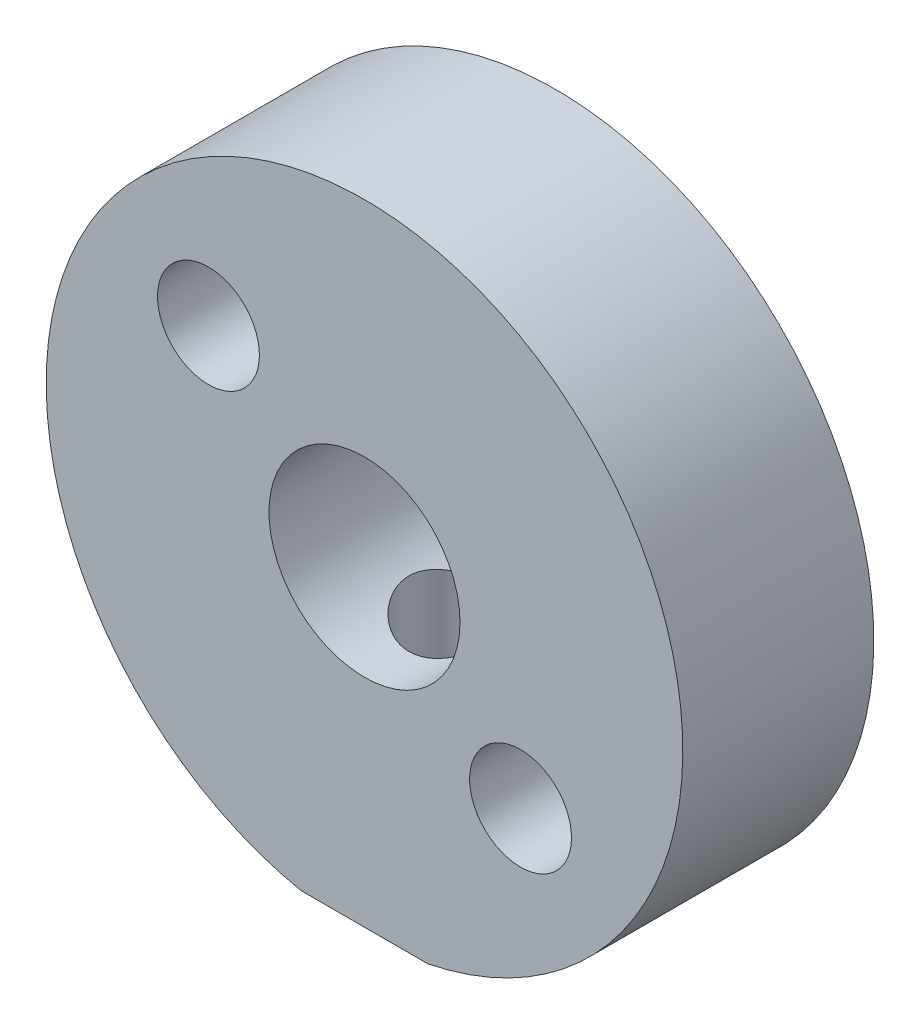
from build123d import *

# Parameters (mm, degrees)
SKETCH1_R           = 5
SKETCH1_R_2         = 1.5
EXTRUDE1_DEPTH      = 1.5
EXTRUDE2_DEPTH      = 8.228416147
EXTRUDE2_DEPTH_BACK = 8.228416147
SKETCH2_R           = 0.8
SKETCH3_R           = 0.8
EXTRUDE3_DEPTH      = 8.228416147
EXTRUDE4_DEPTH      = 8.228416306
EXTRUDE4_DEPTH_BACK = 8.228416306
SKETCH4_W           = 4.205463009
SKETCH4_H           = 0.572765835
SKETCH4_W_2         = 4.092184544


with BuildPart() as part:
    # Sketch1 → Extrude1 (new, symmetric)
    with BuildSketch(Plane.XY):
        Circle(SKETCH1_R)
        Circle(SKETCH1_R_2, mode=Mode.SUBTRACT)
    extrude(amount=EXTRUDE1_DEPTH, both=True)

    # Sketch2 → Extrude2 (cut, two sides: drawn at the far end of the back side and taken through both)
    with BuildSketch(Plane.XY.offset(-EXTRUDE2_DEPTH_BACK)):
        with Locations((-2.451342218, 2.056920351)):
            Circle(SKETCH2_R)
        with Locations((2.451342218, -2.056920351)):
            Circle(SKETCH2_R)
    extrude(amount=EXTRUDE2_DEPTH + EXTRUDE2_DEPTH_BACK, mode=Mode.SUBTRACT)

    # Sketch3 → Extrude3 (cut, through all)
    with BuildSketch(Plane(origin=(0, 0, 0), x_dir=(1, 0, 0), z_dir=(0, 1, 0))):
        with Locations(Location((0, 0, 0), (0, 0, 270))):
            Circle(SKETCH3_R)
    extrude(amount=-EXTRUDE3_DEPTH, mode=Mode.SUBTRACT)

    # Sketch4 → Extrude4 (cut, two sides: drawn at the far end of the back side and taken through both)
    with BuildSketch(Plane.XY.offset(-EXTRUDE4_DEPTH_BACK)):
        with Locations((-2.102731505, -5.186382918)):
            Rectangle(SKETCH4_W, SKETCH4_H)
        with Locations((2.046092272, -5.186382918)):
            Rectangle(SKETCH4_W_2, SKETCH4_H)
    extrude(amount=EXTRUDE4_DEPTH + EXTRUDE4_DEPTH_BACK, mode=Mode.SUBTRACT)


solid = part.part
